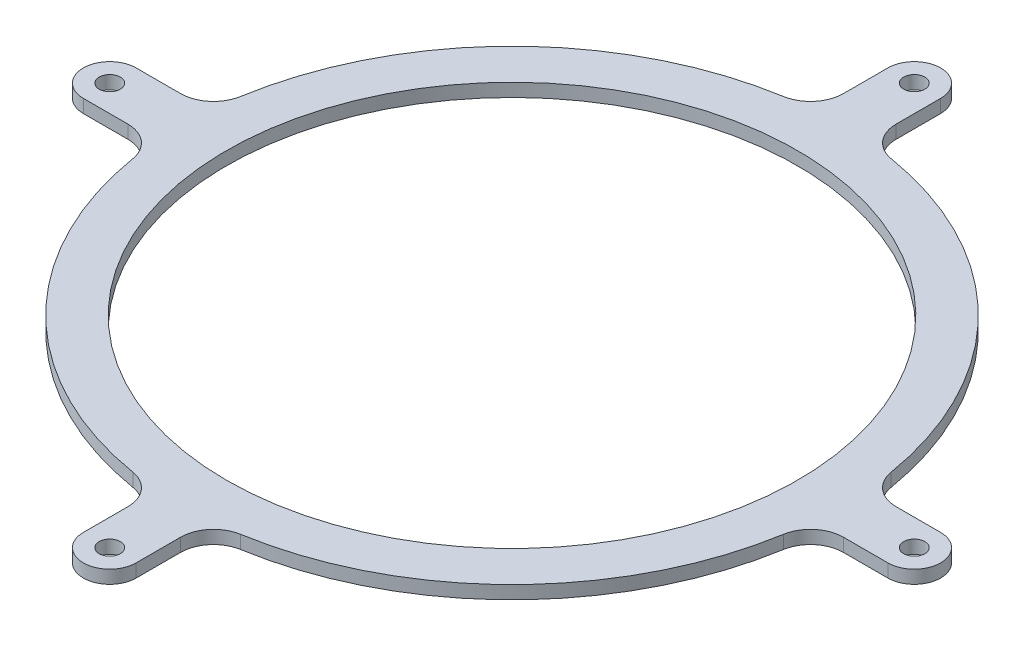
from build123d import *

# Parameters (mm, degrees)
SKETCH_1_R      = 50
SKETCH_1_R_2    = 43.3
EXTRUDE_1_DEPTH = 2
SKETCH_2_R      = 1.6
EXTRUDE_2_DEPTH = 2
FILLET_1_R      = 5


with BuildPart() as part:
    # 草图1 → 凸台-拉伸1 (new body)
    with BuildSketch(Plane(origin=(0, 0, 0), x_dir=(1, 0, 0), z_dir=(0, 1, 0))):
        with Locations(Location((0, 0, 0), (0, 0, 270))):
            Circle(SKETCH_1_R)
        with Locations(Location((0, 0, 0), (0, 0, 270))):
            Circle(SKETCH_1_R_2, mode=Mode.SUBTRACT)
    extrude(amount=EXTRUDE_1_DEPTH)

    # 草图2 → 凸台-拉伸2 (add)
    # profile 1 of 4: a face of its own
    with BuildSketch(Plane(origin=(0, 2, 0), x_dir=(1, 0, 0), z_dir=(0, 1, 0))):
        with BuildLine():
            Line((47.683371348, 4), (47.683371348, -4))
            Line((47.683371348, -4), (61, -4))
            ThreePointArc((61, -4), (65, 0), (61, 4))
            Line((61, 4), (47.683371348, 4))
        make_face()
        with Locations(Location((61, 0, 0), (0, 0, 270))):
            Circle(SKETCH_2_R, mode=Mode.SUBTRACT)
    # profile 2 of 4: a face of its own
    with BuildSketch(Plane(origin=(0, 2, 0), x_dir=(1, 0, 0), z_dir=(0, 1, 0))):
        with BuildLine():
            Line((-4, -61), (-4, -47.683371348))
            Line((-4, -47.683371348), (4, -47.683371348))
            Line((4, -47.683371348), (4, -61))
            ThreePointArc((4, -61), (0, -65), (-4, -61))
        make_face()
        with Locations(Location((0, -61, 0), (0, 0, 270))):
            Circle(SKETCH_2_R, mode=Mode.SUBTRACT)
    # profile 3 of 4: a face of its own
    with BuildSketch(Plane(origin=(0, 2, 0), x_dir=(1, 0, 0), z_dir=(0, 1, 0))):
        with BuildLine():
            Line((-61, 4), (-47.683371348, 4))
            Line((-47.683371348, 4), (-47.683371348, -4))
            Line((-47.683371348, -4), (-61, -4))
            ThreePointArc((-61, -4), (-65, 0), (-61, 4))
        make_face()
        with Locations(Location((-61, 0, 0), (0, 0, 270))):
            Circle(SKETCH_2_R, mode=Mode.SUBTRACT)
    # profile 4 of 4: a face of its own
    with BuildSketch(Plane(origin=(0, 2, 0), x_dir=(1, 0, 0), z_dir=(0, 1, 0))):
        with BuildLine():
            Line((4, 61), (4, 47.683371348))
            Line((4, 47.683371348), (-4, 47.683371348))
            Line((-4, 47.683371348), (-4, 61))
            ThreePointArc((-4, 61), (0, 65), (4, 61))
        make_face()
        with Locations(Location((0, 61, 0), (0, 0, 270))):
            Circle(SKETCH_2_R, mode=Mode.SUBTRACT)
    extrude(amount=-EXTRUDE_2_DEPTH)

    # 圆角1
    fillet_1_edges = [part.edges().sort_by_distance(p)[0] for p in [
        (49.839743178, 1, -4),
        (49.839743178, 1, 4),
        (-4, 1, 49.839743178),
        (4, 1, 49.839743178),
        (-49.839743178, 1, -4),
        (-49.839743178, 1, 4),
        (4, 1, -49.839743178),
        (-4, 1, -49.839743178),
    ]]
    fillet(fillet_1_edges, radius=FILLET_1_R)


solid = part.part
